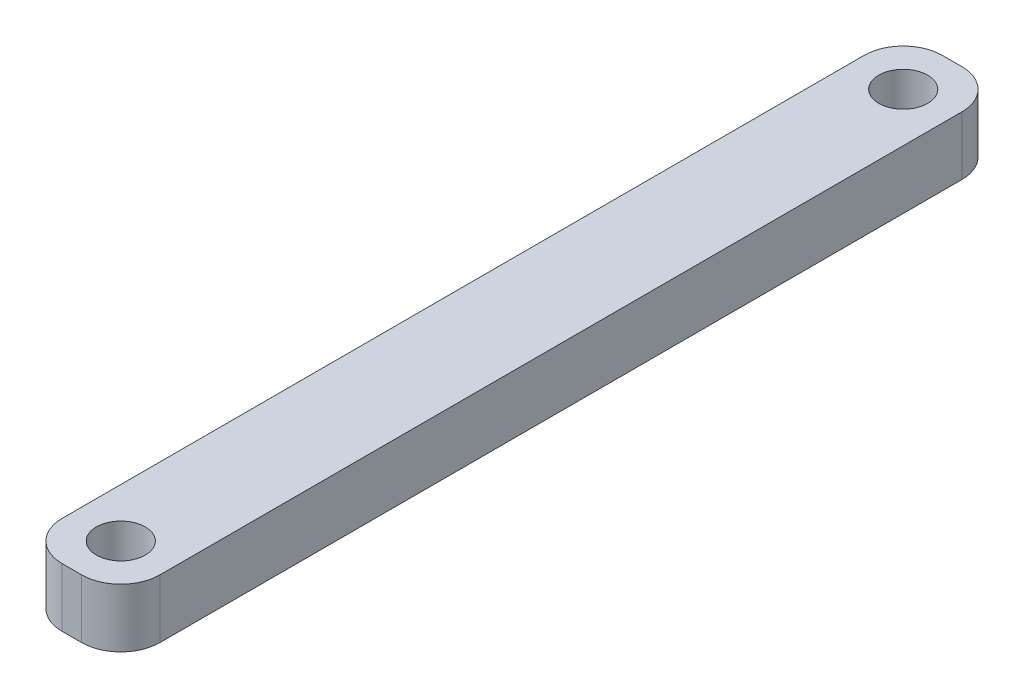
from build123d import *

# Parameters (mm, degrees)
SKETCH1_W           = 5
SKETCH1_H           = 45
SKETCH1_R           = 1.25
BOSS_EXTRUDE1_DEPTH = 3
FILLET1_R           = 2


with BuildPart() as part:
    # Sketch1 → Boss-Extrude1 (new body)
    with BuildSketch(Plane(origin=(0, 0, 0), x_dir=(1, 0, 0), z_dir=(0, 1, 0))):
        Rectangle(SKETCH1_W, SKETCH1_H)
        with Locations(Location((0, 20, 0), (0, 0, 270))):
            Circle(SKETCH1_R, mode=Mode.SUBTRACT)
        with Locations(Location((0, -20, 0), (0, 0, 90))):
            Circle(SKETCH1_R, mode=Mode.SUBTRACT)
    extrude(amount=BOSS_EXTRUDE1_DEPTH)

    # Fillet1
    fillet1_edges = [part.edges().sort_by_distance(p)[0] for p in [
        (2.5, 1.5, 22.5),
        (-2.5, 1.5, 22.5),
        (-2.5, 1.5, -22.5),
        (2.5, 1.5, -22.5),
    ]]
    fillet(fillet1_edges, radius=FILLET1_R)


solid = part.part
